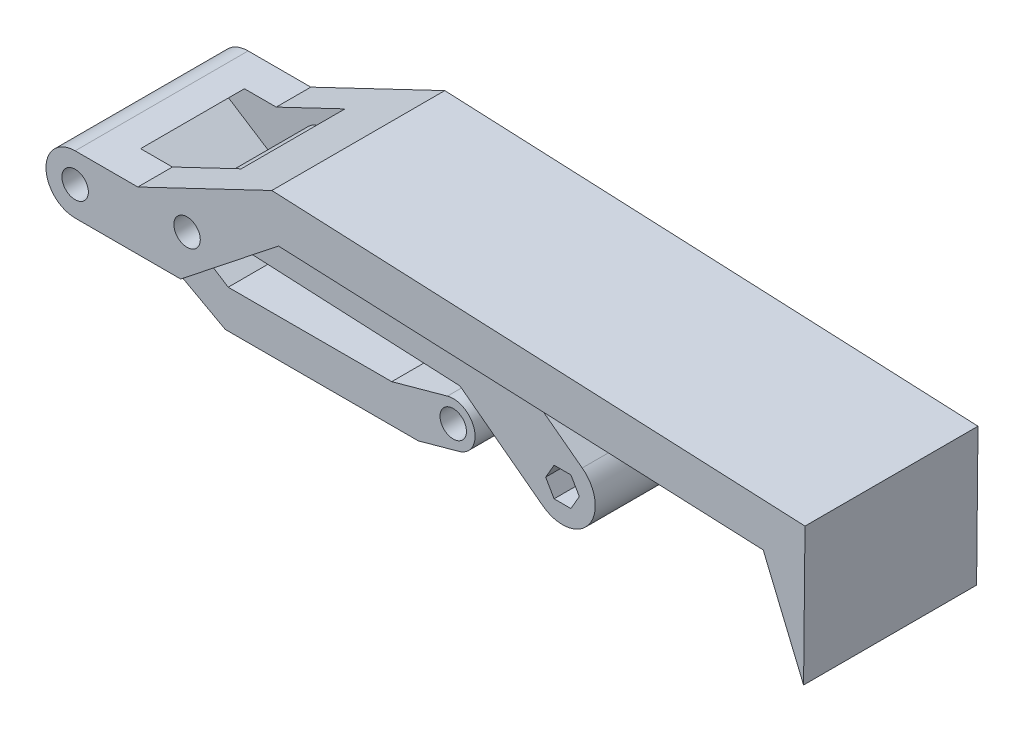
from build123d import *

# Parameters (mm, degrees)
SKETCH5_R                = 3.628504089
BOSS_EXTRUDE3_DEPTH      = 27.5
BOSS_EXTRUDE3_2_DEPTH    = 27.5
BOSS_EXTRUDE4_DEPTH      = 23.75
BOSS_EXTRUDE4_DEPTH_BACK = 23.75
SKETCH6_R                = 3.628504089
CUT_EXTRUDE2_DEPTH       = 14.25
CUT_EXTRUDE2_DEPTH_BACK  = 14.25


with BuildPart() as part:
    # Sketch5 → Boss-Extrude3 (new body)
    with BuildSketch(Plane.XY):
        with BuildLine():
            Line((-120.934685686, 20.267091554), (-91.785043878, 1.576891431))
            Line((-91.785043878, 1.576891431), (-46.879701458, 1.576891431))
            Line((-46.879701458, 1.576891431), (-31.592321802, 5.78485188))
            ThreePointArc((-31.592321802, 5.78485188), (-24.21514812, 1.592321802), (-28.407678198, -5.78485188))
            Line((-28.407678198, -5.78485188), (-39.607557444, -8.867698645))
            Line((-39.607557444, -8.867698645), (-92.588788243, -8.867698645))
            Line((-92.588788243, -8.867698645), (-126.681944707, 9.732908446))
            ThreePointArc((-126.681944707, 9.732908446), (-129.07540675, 17.87362951), (-120.934685686, 20.267091554))
        make_face()
        with Locations((-123.808315196, 15)):
            Circle(SKETCH5_R, mode=Mode.SUBTRACT)
        with Locations((-30, 0)):
            Circle(SKETCH5_R, mode=Mode.SUBTRACT)
    extrude(amount=BOSS_EXTRUDE3_DEPTH)


with BuildPart() as body_2:
    # Sketch5 → Boss-Extrude3 2 (new body)
    with BuildSketch(Plane.XY):
        with BuildLine():
            Line((-5.4116656, -7.191236016), (-28.151470977, 9.921291265))
            Line((-28.151470977, 9.921291265), (-93.359787057, 13.046109847))
            ThreePointArc((-93.359787057, 13.046109847), (-99.065716006, 19.326426306), (-92.785399546, 25.032355255))
            Line((-92.785399546, 25.032355255), (-13.230357407, 21.220033624))
            Line((-13.230357407, 21.220033624), (5.4116656, 7.191236016))
            ThreePointArc((5.4116656, 7.191236016), (7.191236016, -5.4116656), (-5.4116656, -7.191236016))
        make_face()
        with Locations((-93.072593302, 19.039232551)):
            Circle(SKETCH5_R, mode=Mode.SUBTRACT)
        Polygon((4.618802154, 0), (2.309401077, 4), (-2.309401077, 4), (-4.618802154, 0), (-2.309401077, -4), (2.309401077, -4), align=None, mode=Mode.SUBTRACT)
    extrude(amount=BOSS_EXTRUDE3_2_DEPTH)


with BuildPart() as body_3:
    # Sketch6 → Boss-Extrude4 (new, two sides: drawn at the far end of the back side and taken through both)
    with BuildSketch(Plane.XY.offset(13.75).offset(-BOSS_EXTRUDE4_DEPTH_BACK)):
        with BuildLine():
            Line((76.191684804, -4.029010555), (65.11100303, 22.550984249))
            Line((65.11100303, 22.550984249), (-67.97614227, 28.273511334))
            Line((-67.97614227, 28.273511334), (-94.831118395, 7))
            Line((-94.831118395, 7), (-123.808315196, 7))
            ThreePointArc((-123.808315196, 7), (-131.808315196, 15), (-123.808315196, 23))
            Line((-123.808315196, 23), (-106.597039785, 23))
            Line((-106.597039785, 23), (-69.813407938, 40.564082784))
            Line((-69.813407938, 40.564082784), (76.579517734, 33.963718739))
            Line((76.579517734, 33.963718739), (76.191684804, -4.029010555))
        make_face()
        with Locations((-93.072593302, 19.039232551)):
            Circle(SKETCH6_R, mode=Mode.SUBTRACT)
        with Locations((-123.808315196, 15)):
            Circle(SKETCH6_R, mode=Mode.SUBTRACT)
    extrude(amount=BOSS_EXTRUDE4_DEPTH + BOSS_EXTRUDE4_DEPTH_BACK)

    # Sketch7 → Cut-Extrude2 (cut, two sides: drawn at the far end of the back side and taken through both)
    with BuildSketch(Plane.XY.offset(13.75).offset(-CUT_EXTRUDE2_DEPTH_BACK)):
        with BuildLine():
            Line((-123.39375762, 18.98225228), (-95.551874481, 32.858901158))
            ThreePointArc((-95.551874481, 32.858901158), (-79.033103969, 18.888186683), (-95.848627976, 5.276104016))
            Line((-95.848627976, 5.276104016), (-124.599937084, 11.075267398))
            ThreePointArc((-124.599937084, 11.075267398), (-127.766300398, 15.603775085), (-123.39375762, 18.98225228))
        make_face()
    extrude(amount=CUT_EXTRUDE2_DEPTH + CUT_EXTRUDE2_DEPTH_BACK, mode=Mode.SUBTRACT)


solid = Compound([part.part, body_2.part, body_3.part])
